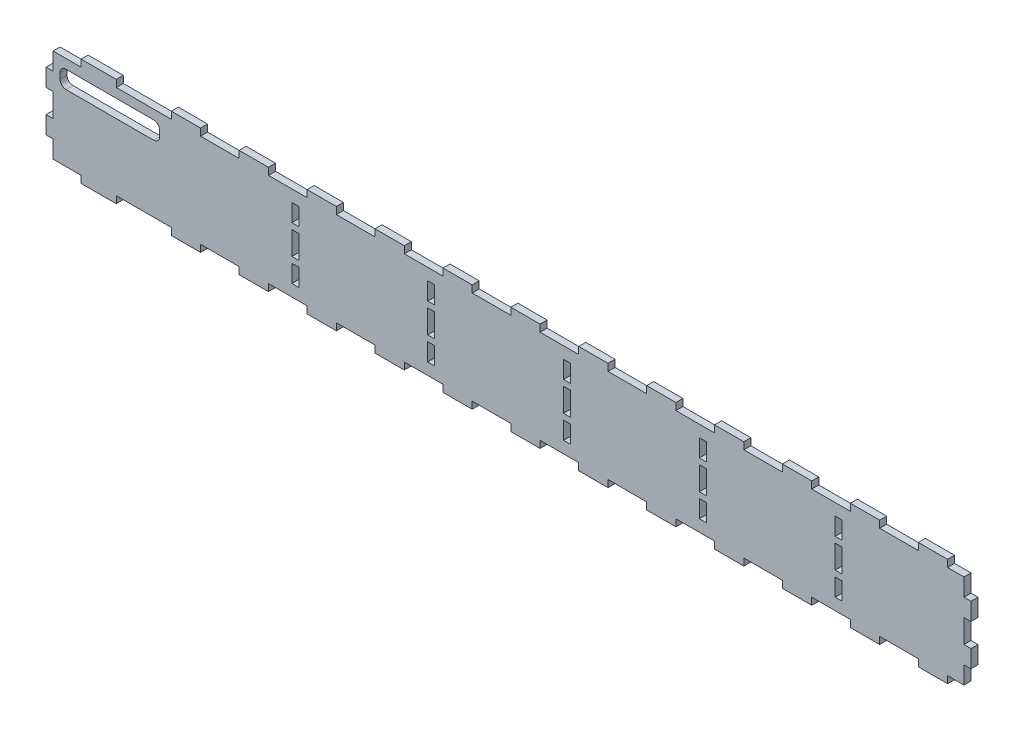
from build123d import *

# Parameters (mm, degrees)
SKETCH1_W           = 790
SKETCH1_H           = 80
BOSS_EXTRUDE1_DEPTH = 6
SKETCH2_W           = 25
SKETCH2_H           = 6
BOSS_EXTRUDE2_DEPTH = 6
SKETCH3_W           = 25
SKETCH3_H           = 6
SKETCH3_W_2         = 30
BOSS_EXTRUDE3_DEPTH = 6
CUT_EXTRUDE1_DEPTH  = 6
SKETCH5_W           = 6
SKETCH5_H           = 15
SKETCH5_H_2         = 20
CUT_EXTRUDE2_DEPTH  = 6
SKETCH7_W           = 6
SKETCH7_H           = 15
SKETCH7_H_2         = 20
CUT_EXTRUDE3_DEPTH  = 6
SKETCH8_W           = 30
SKETCH8_H           = 6
BOSS_EXTRUDE6_DEPTH = 6
SKETCH9_W           = 6
SKETCH9_H           = 20
SKETCH9_H_2         = 15
CUT_EXTRUDE4_DEPTH  = 6


with BuildPart() as part:
    # Sketch1 → Boss-Extrude1 (new body)
    with BuildSketch(Plane.XY):
        Rectangle(SKETCH1_W, SKETCH1_H)
    extrude(amount=BOSS_EXTRUDE1_DEPTH)

    # Sketch2 → Boss-Extrude2 (add)
    with BuildSketch(Plane(origin=(0, 40, 0), x_dir=(1, 0, 0), z_dir=(0, 1, 0))):
        with Locations((362.5, -3)):
            Rectangle(SKETCH2_W, SKETCH2_H)
        with Locations((304.5, -3)):
            Rectangle(SKETCH2_W, SKETCH2_H)
        with Locations((246.5, -3)):
            Rectangle(SKETCH2_W, SKETCH2_H)
        with Locations((188.5, -3)):
            Rectangle(SKETCH2_W, SKETCH2_H)
        with Locations((130.5, -3)):
            Rectangle(SKETCH2_W, SKETCH2_H)
        with Locations((72.5, -3)):
            Rectangle(SKETCH2_W, SKETCH2_H)
        with Locations((14.5, -3)):
            Rectangle(SKETCH2_W, SKETCH2_H)
        with Locations((-43.5, -3)):
            Rectangle(SKETCH2_W, SKETCH2_H)
        with Locations((-101.5, -3)):
            Rectangle(SKETCH2_W, SKETCH2_H)
        with Locations((-159.5, -3)):
            Rectangle(SKETCH2_W, SKETCH2_H)
        with Locations((-217.5, -3)):
            Rectangle(SKETCH2_W, SKETCH2_H)
        with Locations((-275.5, -3)):
            Rectangle(SKETCH2_W, SKETCH2_H)
    extrude(amount=BOSS_EXTRUDE2_DEPTH)

    # Sketch3 → Boss-Extrude3 (add)
    with BuildSketch(Plane.XZ.offset(40)):
        with Locations((-275.5, 3)):
            Rectangle(SKETCH3_W, SKETCH3_H)
        with Locations((-217.5, 3)):
            Rectangle(SKETCH3_W, SKETCH3_H)
        with Locations((-159.5, 3)):
            Rectangle(SKETCH3_W, SKETCH3_H)
        with Locations((-101.5, 3)):
            Rectangle(SKETCH3_W, SKETCH3_H)
        with Locations((-43.5, 3)):
            Rectangle(SKETCH3_W, SKETCH3_H)
        with Locations((14.5, 3)):
            Rectangle(SKETCH3_W, SKETCH3_H)
        with Locations((72.5, 3)):
            Rectangle(SKETCH3_W, SKETCH3_H)
        with Locations((130.5, 3)):
            Rectangle(SKETCH3_W, SKETCH3_H)
        with Locations((188.5, 3)):
            Rectangle(SKETCH3_W, SKETCH3_H)
        with Locations((246.5, 3)):
            Rectangle(SKETCH3_W, SKETCH3_H)
        with Locations((304.5, 3)):
            Rectangle(SKETCH3_W, SKETCH3_H)
        with Locations((362.5, 3)):
            Rectangle(SKETCH3_W, SKETCH3_H)
        with Locations((-350, 3)):
            Rectangle(SKETCH3_W_2, SKETCH3_H)
    extrude(amount=BOSS_EXTRUDE3_DEPTH)

    # Sketch4 → Cut-Extrude1 (cut)
    with BuildSketch(Plane(origin=(0, 0, 0), x_dir=(-1, 0, 0), z_dir=(0, 0, -1))):
        with BuildLine():
            Line((378, 17), (303, 17))
            ThreePointArc((303, 17), (299.464466094, 18.464466094), (298, 22))
            Line((298, 22), (298, 27))
            ThreePointArc((298, 27), (299.464466094, 30.535533906), (303, 32))
            Line((303, 32), (378, 32))
            ThreePointArc((378, 32), (381.535533906, 30.535533906), (383, 27))
            Line((383, 27), (383, 22))
            ThreePointArc((383, 22), (381.535533906, 18.464466094), (378, 17))
        make_face()
    extrude(amount=-CUT_EXTRUDE1_DEPTH, mode=Mode.SUBTRACT)

    # Sketch5 → Cut-Extrude2 (cut)
    with BuildSketch(Plane.ZY.offset(395)):
        with Locations((3, -32.5)):
            Rectangle(SKETCH5_W, SKETCH5_H)
        with Locations((3, 0)):
            Rectangle(SKETCH5_W, SKETCH5_H_2)
        with Locations((3, 32.5)):
            Rectangle(SKETCH5_W, SKETCH5_H)
    extrude(amount=-CUT_EXTRUDE2_DEPTH, mode=Mode.SUBTRACT)

    # Sketch7 → Cut-Extrude3 (cut)
    with BuildSketch(Plane(origin=(395, 0, 0), x_dir=(0, 0, -1), z_dir=(1, 0, 0))):
        with Locations((-3, 32.5)):
            Rectangle(SKETCH7_W, SKETCH7_H)
        with Locations((-3, 0)):
            Rectangle(SKETCH7_W, SKETCH7_H_2)
        with Locations((-3, -32.5)):
            Rectangle(SKETCH7_W, SKETCH7_H)
    extrude(amount=-CUT_EXTRUDE3_DEPTH, mode=Mode.SUBTRACT)

    # Sketch8 → Boss-Extrude6 (add)
    with BuildSketch(Plane(origin=(0, 40, 0), x_dir=(1, 0, 0), z_dir=(0, 1, 0))):
        with Locations((-350, -3)):
            Rectangle(SKETCH8_W, SKETCH8_H)
    extrude(amount=BOSS_EXTRUDE6_DEPTH)

    # Sketch9 → Cut-Extrude4 (cut)
    with BuildSketch(Plane.XY.offset(6)):
        with Locations((166, 0)):
            Rectangle(SKETCH9_W, SKETCH9_H)
        with Locations((282, 0)):
            Rectangle(SKETCH9_W, SKETCH9_H)
        with Locations((166, -22.5)):
            Rectangle(SKETCH9_W, SKETCH9_H_2)
        with Locations((166, 22.5)):
            Rectangle(SKETCH9_W, SKETCH9_H_2)
        with Locations((50, 0)):
            Rectangle(SKETCH9_W, SKETCH9_H)
        with Locations((50, -22.5)):
            Rectangle(SKETCH9_W, SKETCH9_H_2)
        with Locations((282, -22.5)):
            Rectangle(SKETCH9_W, SKETCH9_H_2)
        with Locations((282, 22.5)):
            Rectangle(SKETCH9_W, SKETCH9_H_2)
        with Locations((50, 22.5)):
            Rectangle(SKETCH9_W, SKETCH9_H_2)
        with Locations((-66, 0)):
            Rectangle(SKETCH9_W, SKETCH9_H)
        with Locations((-66, -22.5)):
            Rectangle(SKETCH9_W, SKETCH9_H_2)
        with Locations((-66, 22.5)):
            Rectangle(SKETCH9_W, SKETCH9_H_2)
        with Locations((-182, 0)):
            Rectangle(SKETCH9_W, SKETCH9_H)
        with Locations((-182, -22.5)):
            Rectangle(SKETCH9_W, SKETCH9_H_2)
        with Locations((-182, 22.5)):
            Rectangle(SKETCH9_W, SKETCH9_H_2)
    extrude(amount=-CUT_EXTRUDE4_DEPTH, mode=Mode.SUBTRACT)


solid = part.part
